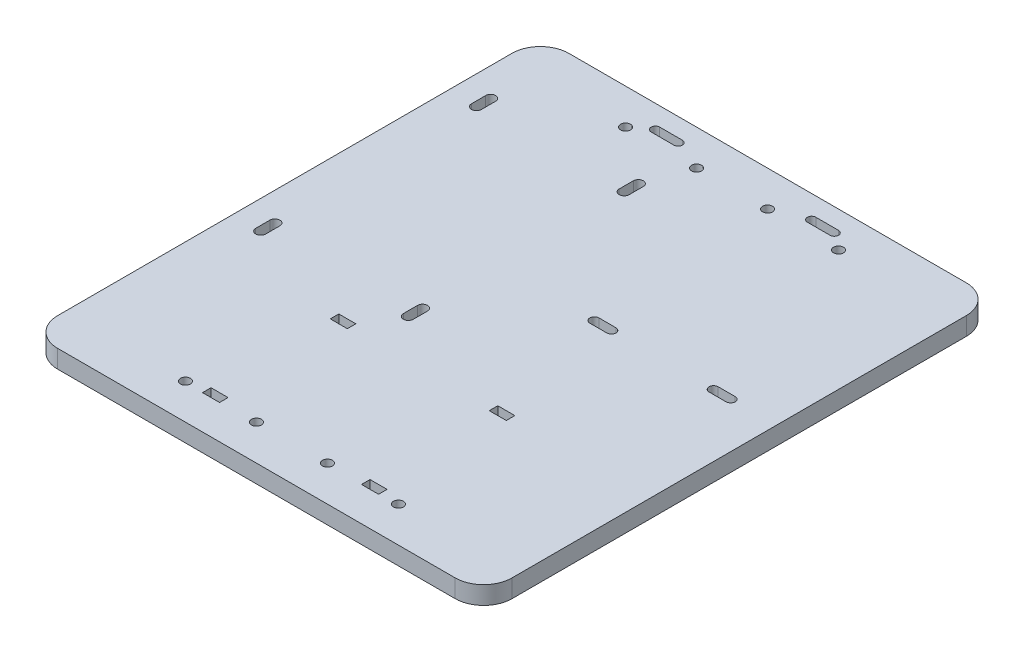
from build123d import *

# Parameters (mm, degrees)
MAIN_DEPTH   = 6.35
ODROID_REACH = 242.916
REG_DEPTH    = 6.35
SKETCH10_W   = 6
SKETCH10_H   = 3
BAT_DEPTH    = 6.35
SKETCH11_R   = 1.75
MOUNT_DEPTH  = 6.35
CAMERA_DEPTH = 6.35


with BuildPart() as part:
    # Sketch1 → main (new body)
    with BuildSketch(Plane(origin=(0, 0, 0), x_dir=(1, 0, 0), z_dir=(0, 1, 0))):
        with BuildLine():
            Line((-10, 0), (-150, 0))
            ThreePointArc((-150, 0), (-157.071067812, 2.928932188), (-160, 10))
            Line((-160, 10), (-160, 170))
            ThreePointArc((-160, 170), (-157.071067812, 177.071067812), (-150, 180))
            Line((-150, 180), (-10, 180))
            ThreePointArc((-10, 180), (-2.928932188, 177.071067812), (0, 170))
            Line((0, 170), (0, 10))
            ThreePointArc((0, 10), (-2.928932188, 2.928932188), (-10, 0))
        make_face()
    extrude(amount=MAIN_DEPTH)

    # Sketch8 → odroid (cut, up to next)
    with BuildSketch(Plane.XZ, mode=Mode.PRIVATE) as odroid_sk1:
        with BuildLine():
            Line((-96.25, -147.5), (-96.25, -152.5))
            ThreePointArc((-96.25, -152.5), (-98, -154.25), (-99.75, -152.5))
            Line((-99.75, -152.5), (-99.75, -147.5))
            ThreePointArc((-99.75, -147.5), (-98, -145.75), (-96.25, -147.5))
        make_face()
    odroid_tool1 = extrude(odroid_sk1.sketch, amount=-ODROID_REACH, mode=Mode.PRIVATE) & part.part
    # Sketch8 → odroid (cut, up to next)
    with BuildSketch(Plane.XZ, mode=Mode.PRIVATE) as odroid_sk2:
        with BuildLine():
            Line((-96.25, -71.5), (-96.25, -76.5))
            ThreePointArc((-96.25, -76.5), (-98, -78.25), (-99.75, -76.5))
            Line((-99.75, -76.5), (-99.75, -71.5))
            ThreePointArc((-99.75, -71.5), (-98, -69.75), (-96.25, -71.5))
        make_face()
    odroid_tool2 = extrude(odroid_sk2.sketch, amount=-ODROID_REACH, mode=Mode.PRIVATE) & part.part
    # Sketch8 → odroid (cut, up to next)
    with BuildSketch(Plane.XZ, mode=Mode.PRIVATE) as odroid_sk3:
        with BuildLine():
            Line((-148.25, -147.5), (-148.25, -152.5))
            ThreePointArc((-148.25, -152.5), (-150, -154.25), (-151.75, -152.5))
            Line((-151.75, -152.5), (-151.75, -147.5))
            ThreePointArc((-151.75, -147.5), (-150, -145.75), (-148.25, -147.5))
        make_face()
    odroid_tool3 = extrude(odroid_sk3.sketch, amount=-ODROID_REACH, mode=Mode.PRIVATE) & part.part
    # Sketch8 → odroid (cut, up to next)
    with BuildSketch(Plane.XZ, mode=Mode.PRIVATE) as odroid_sk4:
        with BuildLine():
            Line((-148.25, -71.5), (-148.25, -76.5))
            ThreePointArc((-148.25, -76.5), (-150, -78.25), (-151.75, -76.5))
            Line((-151.75, -76.5), (-151.75, -71.5))
            ThreePointArc((-151.75, -71.5), (-150, -69.75), (-148.25, -71.5))
        make_face()
    odroid_tool4 = extrude(odroid_sk4.sketch, amount=-ODROID_REACH, mode=Mode.PRIVATE) & part.part
    add(odroid_tool1.solids().sort_by_distance((-98, 0, -150))[0], mode=Mode.SUBTRACT)
    add(odroid_tool2.solids().sort_by_distance((-98, 0, -74))[0], mode=Mode.SUBTRACT)
    add(odroid_tool3.solids().sort_by_distance((-150, 0, -150))[0], mode=Mode.SUBTRACT)
    add(odroid_tool4.solids().sort_by_distance((-150, 0, -74))[0], mode=Mode.SUBTRACT)

    # Sketch9 → reg (cut)
    with BuildSketch(Plane.XZ):
        with BuildLine():
            Line((-58, -104.6), (-64, -104.6))
            ThreePointArc((-64, -104.6), (-65.6, -103), (-64, -101.4))
            Line((-64, -101.4), (-58, -101.4))
            ThreePointArc((-58, -101.4), (-56.4, -103), (-58, -104.6))
        make_face()
        with BuildLine():
            Line((-16, -104.6), (-22, -104.6))
            ThreePointArc((-22, -104.6), (-23.6, -103), (-22, -101.4))
            Line((-22, -101.4), (-16, -101.4))
            ThreePointArc((-16, -101.4), (-14.4, -103), (-16, -104.6))
        make_face()
    extrude(amount=-REG_DEPTH, mode=Mode.SUBTRACT)

    # Sketch10 → bat (cut)
    with BuildSketch(Plane.XZ):
        with Locations((-52, -58.5)):
            Rectangle(SKETCH10_W, SKETCH10_H)
        with Locations((-108, -13.5)):
            Rectangle(SKETCH10_W, SKETCH10_H)
        with Locations((-108, -58.5)):
            Rectangle(SKETCH10_W, SKETCH10_H)
        with Locations((-52, -13.5)):
            Rectangle(SKETCH10_W, SKETCH10_H)
    extrude(amount=-BAT_DEPTH, mode=Mode.SUBTRACT)

    # Sketch11 → mount (cut)
    with BuildSketch(Plane.XZ):
        with Locations(Location((-67.5, -167.5, 0), (0, 0, 270))):
            Circle(SKETCH11_R)
        with Locations(Location((-42.5, -167.5, 0), (0, 0, 270))):
            Circle(SKETCH11_R)
        with Locations(Location((-117.5, -12.5, 0), (0, 0, 270))):
            Circle(SKETCH11_R)
        with Locations(Location((-92.5, -167.5, 0), (0, 0, 90))):
            Circle(SKETCH11_R)
        with Locations(Location((-92.5, -12.5, 0), (0, 0, 270))):
            Circle(SKETCH11_R)
        with Locations(Location((-42.5, -12.5, 0), (0, 0, 90))):
            Circle(SKETCH11_R)
        with Locations(Location((-67.5, -12.5, 0), (0, 0, 90))):
            Circle(SKETCH11_R)
        with Locations(Location((-117.5, -167.5, 0), (0, 0, 90))):
            Circle(SKETCH11_R)
    extrude(amount=-MOUNT_DEPTH, mode=Mode.SUBTRACT)

    # Sketch12 → camera (cut)
    with BuildSketch(Plane.XZ):
        with BuildLine():
            Line((-48.5, -173.5), (-56.5, -173.5))
            ThreePointArc((-56.5, -173.5), (-58, -172), (-56.5, -170.5))
            Line((-56.5, -170.5), (-48.5, -170.5))
            ThreePointArc((-48.5, -170.5), (-47, -172), (-48.5, -173.5))
        make_face()
        with BuildLine():
            Line((-111.5, -173.5), (-103.5, -173.5))
            ThreePointArc((-103.5, -173.5), (-102, -172), (-103.5, -170.5))
            Line((-103.5, -170.5), (-111.5, -170.5))
            ThreePointArc((-111.5, -170.5), (-113, -172), (-111.5, -173.5))
        make_face()
    extrude(amount=-CAMERA_DEPTH, mode=Mode.SUBTRACT)


solid = part.part
